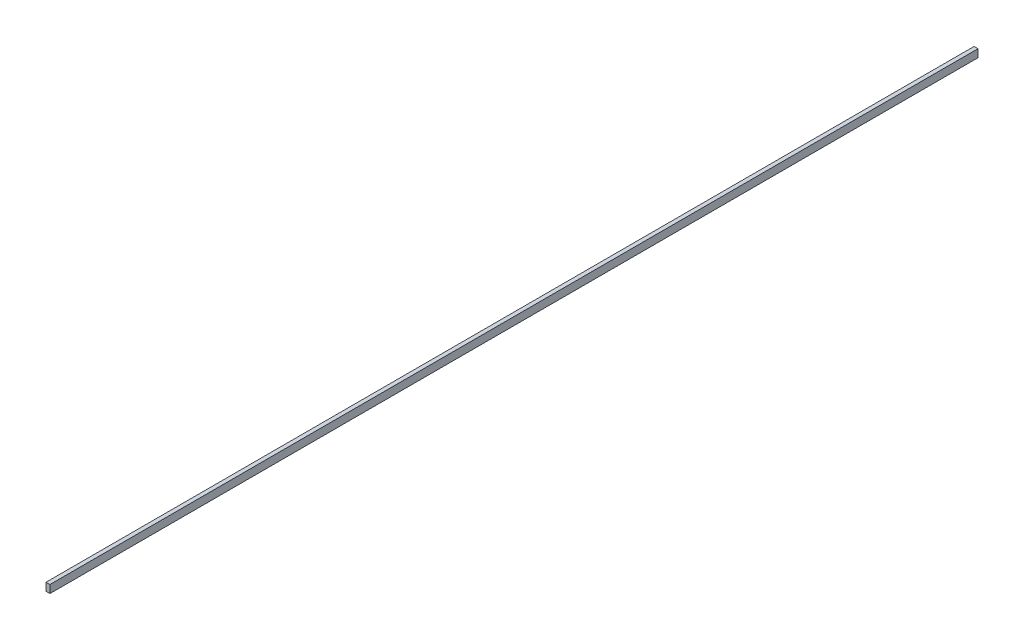
from build123d import *

# Parameters (mm, degrees)
CROQUIS1_W              = 25.4
CROQUIS1_H              = 50.8
SALIENTE_EXTRUIR1_DEPTH = 6000


with BuildPart() as part:
    # Croquis1 → Saliente-Extruir1 (new body)
    with BuildSketch(Plane.XY):
        with Locations((12.7, -25.4)):
            Rectangle(CROQUIS1_W, CROQUIS1_H)
    extrude(amount=SALIENTE_EXTRUIR1_DEPTH)


solid = part.part
